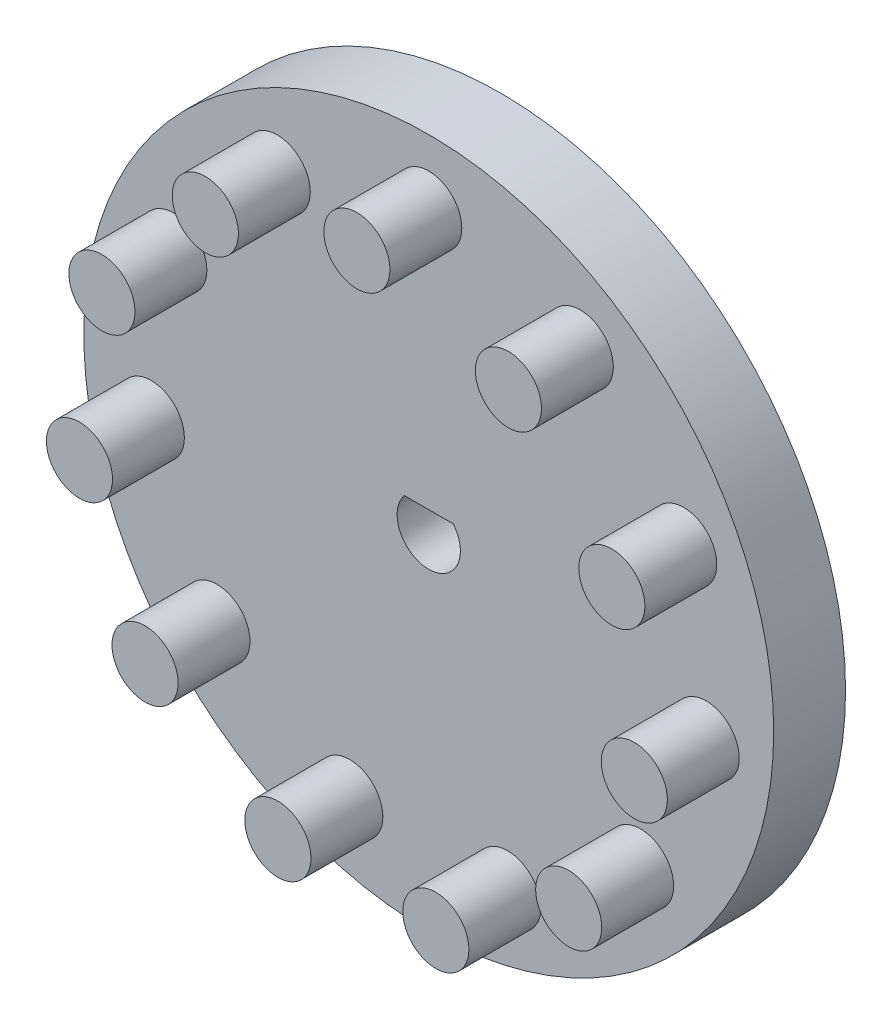
from build123d import *

# Parameters (mm, degrees)
SKETCH1_R           = 15.24
SKETCH1_R_2         = 1.4605
BOSS_EXTRUDE1_DEPTH = 3.175
SKETCH1_7_R         = 1.4605
BOSS_EXTRUDE4_DEPTH = 6.35
CIRPATTERN4_COUNT   = 11


with BuildPart() as part:
    # Sketch1 → Boss-Extrude1 (new body)
    with BuildSketch(Plane.XY):
        Circle(SKETCH1_R)
        with Locations((0, 12.3825)):
            Circle(SKETCH1_R_2, mode=Mode.SUBTRACT)
        with BuildLine():
            Line((-1.0795, 0.886729243), (1.0795, 0.886729243))
            ThreePointArc((1.0795, 0.886729243), (0, -1.397), (-1.0795, 0.886729243))
        make_face(mode=Mode.SUBTRACT)
    extrude(amount=BOSS_EXTRUDE1_DEPTH)

    # Sketch1<7> → Boss-Extrude4 (add)
    with BuildSketch(Plane.XY):
        with Locations((0, 12.3825)):
            Circle(SKETCH1_7_R)
    boss_extrude4 = extrude(amount=BOSS_EXTRUDE4_DEPTH)

    # CirPattern4: Boss-Extrude4 ×11 about axis
    cirpattern4_axis = Axis((0, 0, 3.175), (0, 0, -1))
    for i in range(1, CIRPATTERN4_COUNT):
        add(boss_extrude4.rotate(cirpattern4_axis, i * 360 / CIRPATTERN4_COUNT))


solid = part.part
